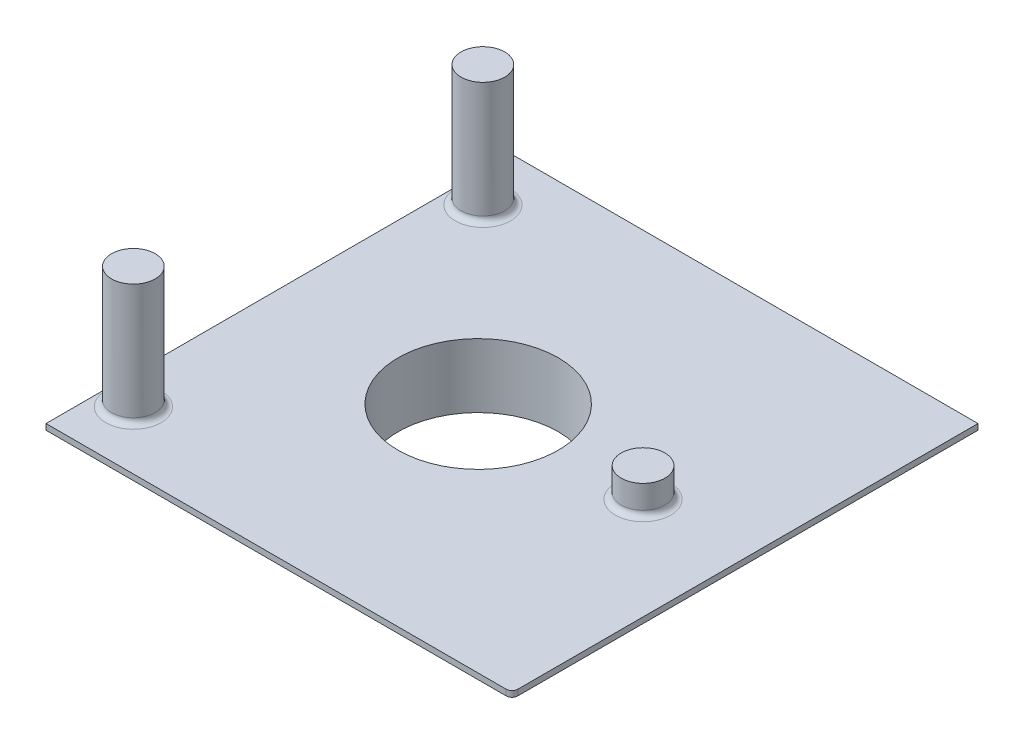
from build123d import *

# Parameters (mm, degrees)
SKETCH1_W           = 203.2
SKETCH1_H           = 203.2
BOSS_EXTRUDE1_DEPTH = 2.54
SKETCH3_R           = 9.525
BOSS_EXTRUDE2_DEPTH = 12.7
SKETCH5_R           = 34.925
CUT_EXTRUDE2_DEPTH  = 145.244271983
SKETCH7_R           = 9.525
BOSS_EXTRUDE4_DEPTH = 53.0225
FILLET1_R           = 2.54
SKETCH8_R           = 40.005
SKETCH8_R_2         = 34.925
BOSS_EXTRUDE5_DEPTH = 25.4
FILLET2_R           = 2.54


with BuildPart() as part:
    # Sketch1 → Boss-Extrude1 (new body)
    with BuildSketch(Plane(origin=(0, 0, 0), x_dir=(1, 0, 0), z_dir=(0, 1, 0))):
        Rectangle(SKETCH1_W, SKETCH1_H)
    extrude(amount=BOSS_EXTRUDE1_DEPTH)

    # Sketch3 → Boss-Extrude2 (add)
    with BuildSketch(Plane(origin=(0, 2.54, 0), x_dir=(1, 0, 0), z_dir=(0, 1, 0))):
        with Locations(Location((57.15, 0, 0), (0, 0, 270))):
            Circle(SKETCH3_R)
    extrude(amount=BOSS_EXTRUDE2_DEPTH)

    # Sketch5 → Cut-Extrude2 (cut, through all)
    with BuildSketch(Plane(origin=(0, 2.54, 0), x_dir=(1, 0, 0), z_dir=(0, 1, 0))):
        with Locations(Location((-14.741985059, 0, 0), (0, 0, 270))):
            Circle(SKETCH5_R)
    extrude(amount=-CUT_EXTRUDE2_DEPTH, mode=Mode.SUBTRACT)

    # Sketch7 → Boss-Extrude4 (add)
    with BuildSketch(Plane(origin=(0, 2.54, 0), x_dir=(1, 0, 0), z_dir=(0, 1, 0))):
        with Locations(Location((-88.9, 76.2, 0), (0, 0, 90))):
            Circle(SKETCH7_R)
    boss_extrude4 = extrude(amount=BOSS_EXTRUDE4_DEPTH)

    # Mirror1: Boss-Extrude4 across plane
    add(boss_extrude4.mirror(Plane.XY))

    # Fillet1
    fillet1_edges = [part.edges().sort_by_distance(p)[0] for p in [
        (101.6, 1.27, 101.6),
    ]]
    fillet(fillet1_edges, radius=FILLET1_R)

    # Sketch8 → Boss-Extrude5 (add)
    with BuildSketch(Plane.XZ):
        with Locations(Location((-14.741985059, 0, 0), (0, 0, 90))):
            Circle(SKETCH8_R)
        with Locations(Location((-14.741985059, 0, 0), (0, 0, 90))):
            Circle(SKETCH8_R_2, mode=Mode.SUBTRACT)
    extrude(amount=BOSS_EXTRUDE5_DEPTH)

    # Fillet2
    fillet2_edges = [part.edges().sort_by_distance(p)[0] for p in [
        (57.15, 2.54, -9.525),
        (-88.9, 2.54, -66.675),
        (-88.9, 2.54, 66.675),
    ]]
    fillet(fillet2_edges, radius=FILLET2_R)


solid = part.part
